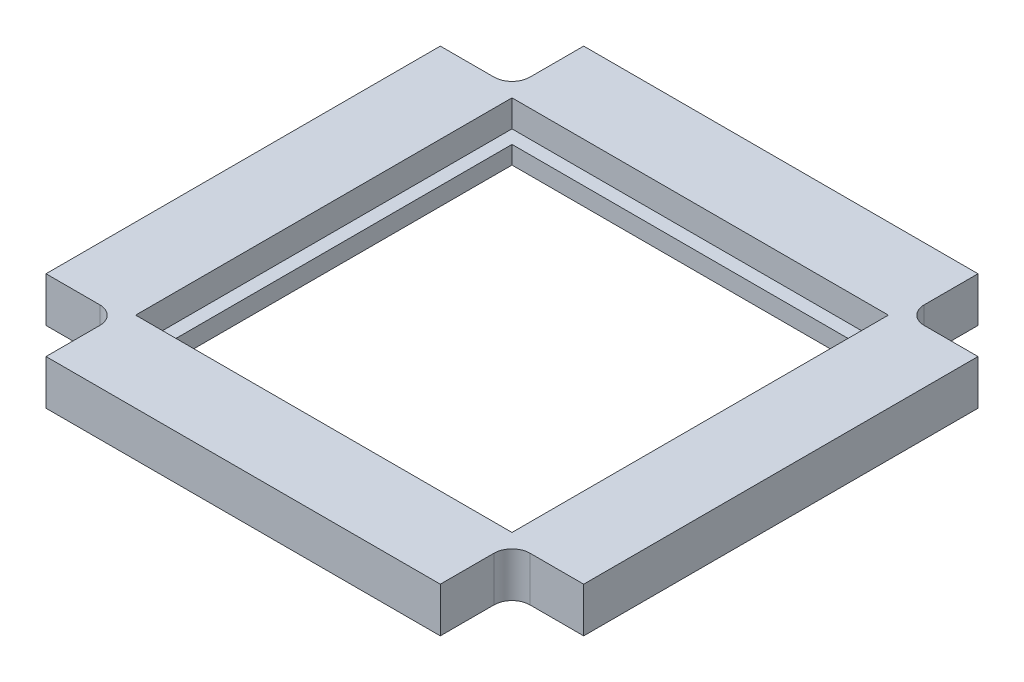
from build123d import *

# Parameters (mm, degrees)
SKETCH_1_W          = 6
SKETCH_1_H          = 6
EXTRUDE_1_DEPTH     = 0.5
SKETCH_2_W          = 3.9
SKETCH_2_H          = 3.9
CUT_EXTRUDE_1_DEPTH = 5.272001873
SKETCH_3_W          = 4.2
SKETCH_3_H          = 4.2
CUT_EXTRUDE_2_DEPTH = 0.3
SKETCH_4_W          = 0.8
SKETCH_4_H          = 0.8
CUT_EXTRUDE_3_DEPTH = 5.272001873
FILLET_2_R          = 0.2


with BuildPart() as part:
    # 草图1 → 凸台-拉伸1 (new body)
    with BuildSketch(Plane(origin=(0, 0, 0), x_dir=(1, 0, 0), z_dir=(0, 1, 0))):
        Rectangle(SKETCH_1_W, SKETCH_1_H)
    extrude(amount=EXTRUDE_1_DEPTH)

    # 草图2 → 切除-拉伸1 (cut, through all)
    with BuildSketch(Plane(origin=(0, 0.5, 0), x_dir=(1, 0, 0), z_dir=(0, 1, 0))):
        Rectangle(SKETCH_2_W, SKETCH_2_H)
    extrude(amount=-CUT_EXTRUDE_1_DEPTH, mode=Mode.SUBTRACT)

    # 草图3 → 切除-拉伸2 (cut)
    with BuildSketch(Plane(origin=(0, 0.5, 0), x_dir=(1, 0, 0), z_dir=(0, 1, 0))):
        Rectangle(SKETCH_3_W, SKETCH_3_H)
    extrude(amount=-CUT_EXTRUDE_2_DEPTH, mode=Mode.SUBTRACT)

    # 草图4 → 切除-拉伸3 (cut, through all)
    with BuildSketch(Plane(origin=(0, 0.5, 0), x_dir=(1, 0, 0), z_dir=(0, 1, 0))):
        with Locations((-2.6, 2.6)):
            Rectangle(SKETCH_4_W, SKETCH_4_H)
        with Locations((2.6, 2.6)):
            Rectangle(SKETCH_4_W, SKETCH_4_H)
        with Locations((-2.6, -2.6)):
            Rectangle(SKETCH_4_W, SKETCH_4_H)
        with Locations((2.6, -2.6)):
            Rectangle(SKETCH_4_W, SKETCH_4_H)
    extrude(amount=-CUT_EXTRUDE_3_DEPTH, mode=Mode.SUBTRACT)

    # 圆角2
    fillet_2_edges = [part.edges().sort_by_distance(p)[0] for p in [
        (-2.2, 0.25, -2.2),
        (2.2, 0.25, -2.2),
        (-2.2, 0.25, 2.2),
        (2.2, 0.25, 2.2),
    ]]
    fillet(fillet_2_edges, radius=FILLET_2_R)


solid = part.part
